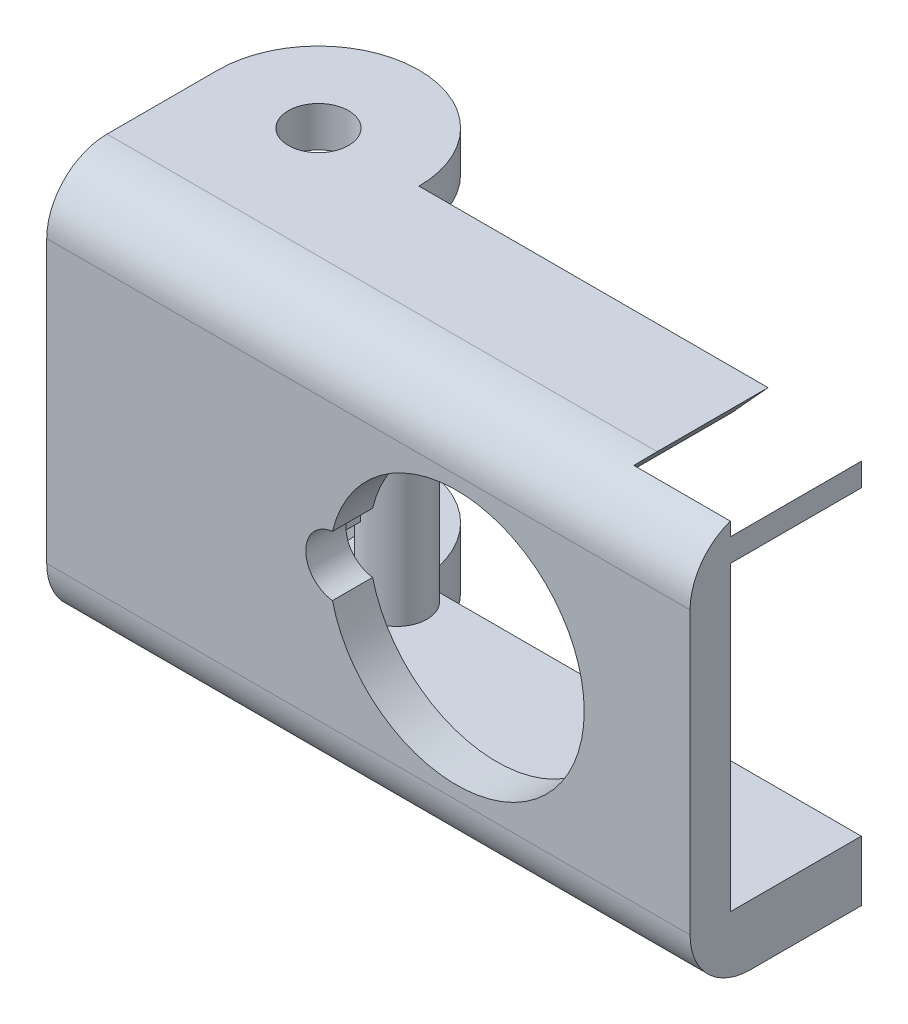
from build123d import *

# Parameters (mm, degrees)
BOSS_EXTRUDE1_DEPTH      = 10
BOSS_EXTRUDE1_DEPTH_BACK = 10
SKETCH1_R                = 1.5
CUT_EXTRUDE1_DEPTH       = 15.053645347
CUT_EXTRUDE1_DEPTH_BACK  = 15.053645347
SKETCH2_W                = 9.15922742
SKETCH2_H                = 4
FILLET1_R                = 3
BOSS_EXTRUDE2_START      = 22
BOSS_EXTRUDE2_DEPTH      = 22
CUT_EXTRUDE2_DEPTH       = 15
CUT_EXTRUDE3_DEPTH       = 15
SKETCH7_R                = 1.5
BOSS_EXTRUDE3_DEPTH      = 17


with BuildPart() as part:
    # Sketch1 → Boss-Extrude1 (new, two sides: drawn at the far end of the back side and taken through both)
    with BuildSketch(Plane(origin=(0, 0, 0), x_dir=(1, 0, 0), z_dir=(0, 1, 0)).offset(-BOSS_EXTRUDE1_DEPTH_BACK)):
        with BuildLine():
            Line((-5, -8.514983708), (5, -8.514983708))
            Line((5, -8.514983708), (5, 0))
            ThreePointArc((5, 0), (0, 5), (-5, 0))
            Line((-5, 0), (-5, -8.514983708))
        make_face()
        Circle(SKETCH1_R, mode=Mode.SUBTRACT)
    extrude(amount=BOSS_EXTRUDE1_DEPTH + BOSS_EXTRUDE1_DEPTH_BACK)

    # Sketch2 → Cut-Extrude1 (cut, two sides: drawn at the far end of the back side and taken through both)
    with BuildSketch(Plane(origin=(0, 0, 0), x_dir=(0, 0, -1), z_dir=(1, 0, 0)).offset(-CUT_EXTRUDE1_DEPTH_BACK)):
        with Locations((0.42038629, 6)):
            Rectangle(SKETCH2_W, SKETCH2_H)
        with Locations((0.42038629, 0.5)):
            Rectangle(SKETCH2_W, SKETCH2_H)
        with Locations((0.42038629, -5)):
            Rectangle(SKETCH2_W, SKETCH2_H)
    extrude(amount=CUT_EXTRUDE1_DEPTH + CUT_EXTRUDE1_DEPTH_BACK, mode=Mode.SUBTRACT)

    # Fillet1
    fillet1_edges = [part.edges().sort_by_distance(p)[0] for p in [
        (0, -10, 8.514983708),
        (0, 10, 8.514983708),
    ]]
    fillet(fillet1_edges, radius=FILLET1_R)

    # Sketch3 → Boss-Extrude2 (add)
    with BuildSketch(Plane(origin=(5, 0, 0), x_dir=(0, 0, -1), z_dir=(1, 0, 0)).offset(BOSS_EXTRUDE2_START)):
        with BuildLine():
            Line((-4.15922742, 8), (-6.514983708, 8))
            Line((-6.514983708, 8), (-6.514983708, -7))
            Line((-6.514983708, -7), (-4.15922742, -7))
            Line((-4.15922742, -7), (0, -7))
            Line((0, -7), (0, -10))
            Line((0, -10), (-5.514983708, -10))
            ThreePointArc((-5.514983708, -10), (-7.636304051, -9.121320344), (-8.514983708, -7))
            Line((-8.514983708, -7), (-8.514983708, 7))
            ThreePointArc((-8.514983708, 7), (-7.636304051, 9.121320344), (-5.514983708, 10))
            Line((-5.514983708, 10), (0, 10))
            Line((0, 10), (0, 8))
            Line((0, 8), (-4.15922742, 8))
        make_face()
    extrude(amount=-BOSS_EXTRUDE2_DEPTH)

    # Sketch4 → Cut-Extrude2 (cut)
    with BuildSketch(Plane(origin=(0, 0, 6.514983708), x_dir=(-1, 0, 0), z_dir=(0, 0, -1))):
        with BuildLine():
            ThreePointArc((-9.210889788, 1.490024104), (-21.733598121, 0), (-9.210889788, -1.490024104))
            ThreePointArc((-9.210889788, -1.490024104), (-7.883598121, 0), (-9.210889788, 1.490024104))
        make_face()
    extrude(amount=-CUT_EXTRUDE2_DEPTH, mode=Mode.SUBTRACT)

    # Sketch6 → Cut-Extrude3 (cut)
    with BuildSketch(Plane(origin=(0, 0, 6.514983708), x_dir=(-1, 0, 0), z_dir=(0, 0, -1))):
        Polygon((-22.036773602, 3.704956115), (-28.57394985, 10.876283833), (-25.617841784, 13.570986989), (-19.080665536, 6.399659271), align=None)
    extrude(amount=CUT_EXTRUDE3_DEPTH, mode=Mode.SUBTRACT)

    # Sketch7 → Boss-Extrude3 (add)
    with BuildSketch(Plane.XZ.offset(-8)):
        with Locations((5.358426028, 1.456547556)):
            Circle(SKETCH7_R)
    extrude(amount=BOSS_EXTRUDE3_DEPTH)


solid = part.part
